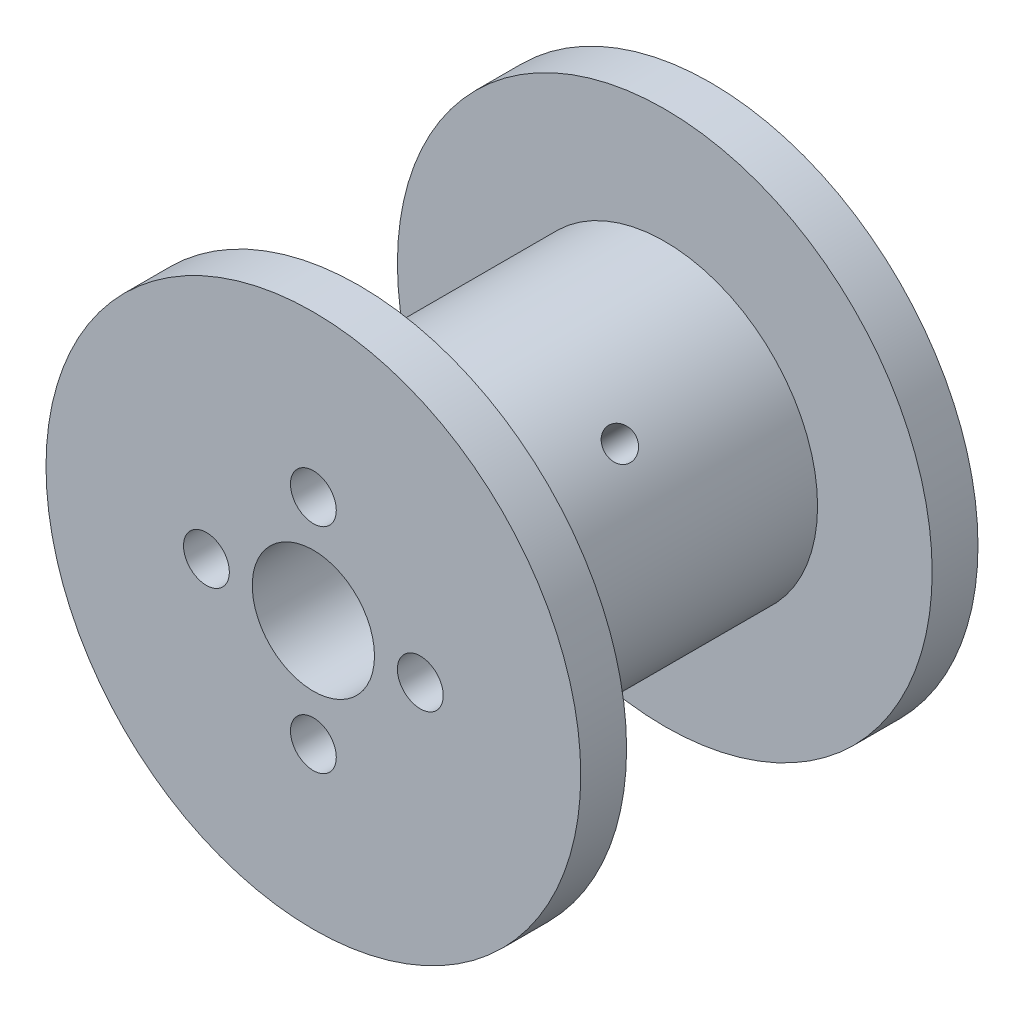
from build123d import *

# Parameters (mm, degrees)
SKETCH_1_R          = 17.5
SKETCH_1_R_2        = 1.5
SKETCH_1_R_3        = 4
EXTRUDE_1_DEPTH     = 23
SKETCH_1_4_R        = 17.5
SKETCH_1_4_R_2      = 10
CUT_EXTRUDE_1_DEPTH = 20
EXTRUDE_START       = -3
SKETCH_1_5_R        = 17.5
SKETCH_1_5_R_2      = 1.5
SKETCH_1_5_R_3      = 4
EXTRUDE_3_DEPTH     = 3
SKETCH_3_R          = 1
CUT_EXTRUDE_2_DEPTH = 9


with BuildPart() as part:
    # 草图1 → 凸台-拉伸1 (new body)
    with BuildSketch(Plane.XY):
        Circle(SKETCH_1_R)
        with Locations((0, 7)):
            Circle(SKETCH_1_R_2, mode=Mode.SUBTRACT)
        with Locations((0, -7)):
            Circle(SKETCH_1_R_2, mode=Mode.SUBTRACT)
        with Locations((7, 0)):
            Circle(SKETCH_1_R_2, mode=Mode.SUBTRACT)
        with Locations((-7, 0)):
            Circle(SKETCH_1_R_2, mode=Mode.SUBTRACT)
        Circle(SKETCH_1_R_3, mode=Mode.SUBTRACT)
    extrude(amount=EXTRUDE_1_DEPTH)

    # 草图1<4> → 切除-拉伸1 (cut)
    with BuildSketch(Plane.XY):
        Circle(SKETCH_1_4_R)
        Circle(SKETCH_1_4_R_2, mode=Mode.SUBTRACT)
    extrude(amount=CUT_EXTRUDE_1_DEPTH, mode=Mode.SUBTRACT)

    # 草图1<5> → 凸台-拉伸3 (add)
    with BuildSketch(Plane.XY.offset(EXTRUDE_START)):
        Circle(SKETCH_1_5_R)
        with Locations((0, 7)):
            Circle(SKETCH_1_5_R_2, mode=Mode.SUBTRACT)
        with Locations((0, -7)):
            Circle(SKETCH_1_5_R_2, mode=Mode.SUBTRACT)
        with Locations((7, 0)):
            Circle(SKETCH_1_5_R_2, mode=Mode.SUBTRACT)
        with Locations((-7, 0)):
            Circle(SKETCH_1_5_R_2, mode=Mode.SUBTRACT)
        Circle(SKETCH_1_5_R_3, mode=Mode.SUBTRACT)
    extrude(amount=EXTRUDE_3_DEPTH)

    # 草图3 → 切除-拉伸2 (cut)
    with BuildSketch(Plane(origin=(7.071067812, 7.071067812, 0), x_dir=(0.7071067811865488, -0.7071067811865462, 0), z_dir=(0.7071067811865462, 0.7071067811865488, 0))):
        with Locations((0, -10)):
            Circle(SKETCH_3_R)
    extrude(amount=-CUT_EXTRUDE_2_DEPTH, mode=Mode.SUBTRACT)


solid = part.part
